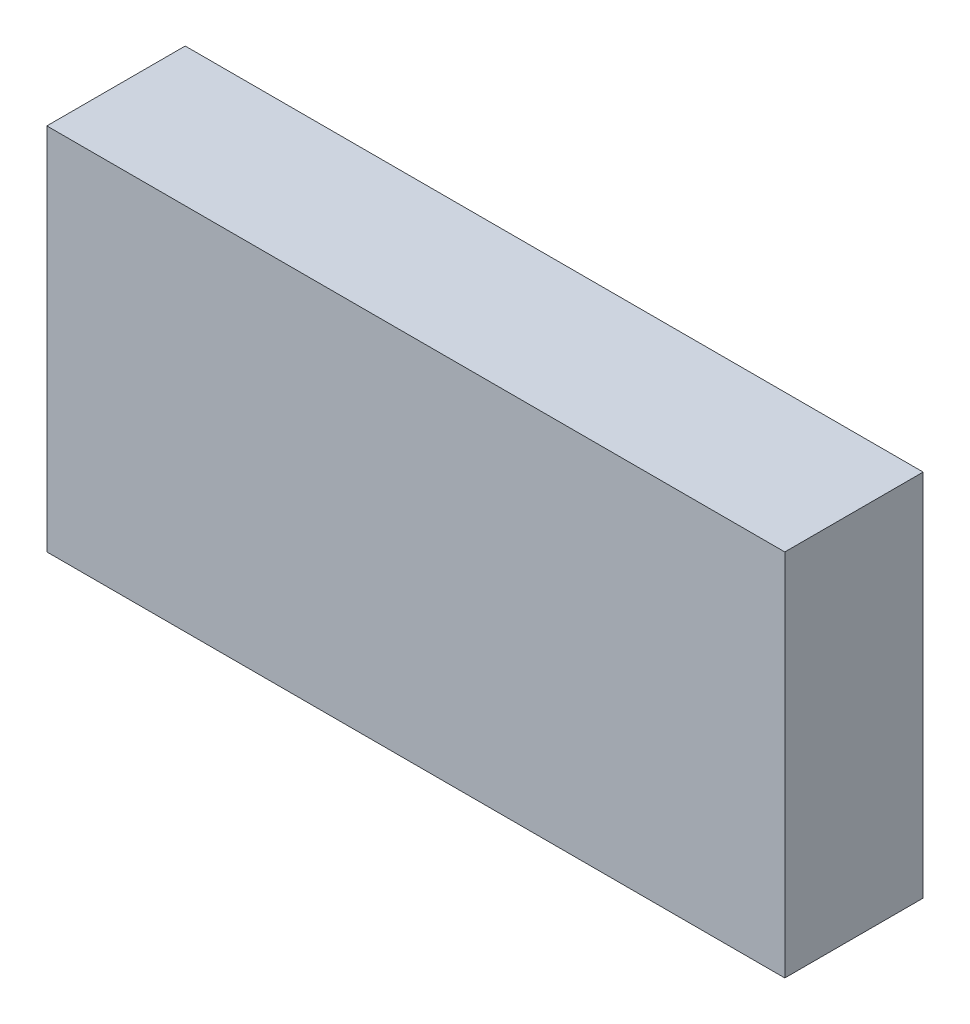
from build123d import *

# Parameters (mm, degrees)
SKETCH1_W           = 80
SKETCH1_H           = 40
BOSS_EXTRUDE1_DEPTH = 15


with BuildPart() as part:
    # Sketch1 → Boss-Extrude1 (new body)
    with BuildSketch(Plane.XY):
        Rectangle(SKETCH1_W, SKETCH1_H)
    extrude(amount=BOSS_EXTRUDE1_DEPTH)


solid = part.part
